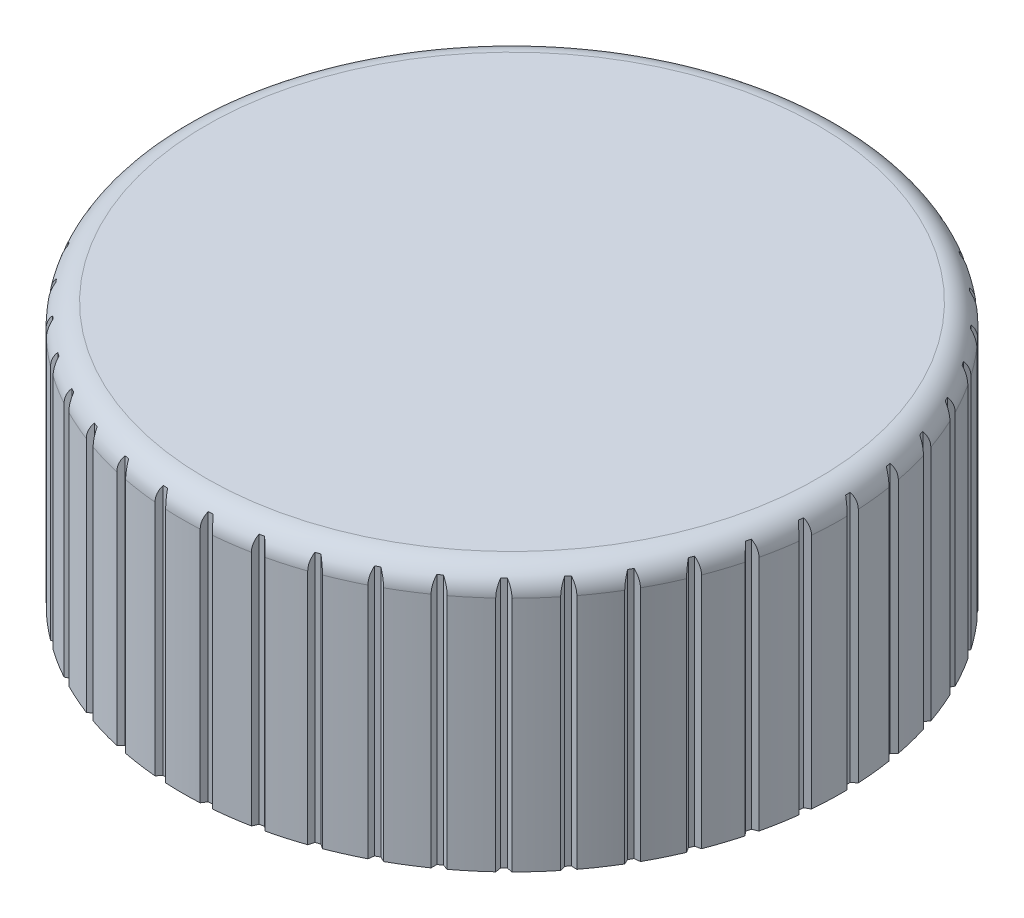
from build123d import *

# Parameters (mm, degrees)
SKETCH_1_R          = 13.9
EXTRUDE_1_DEPTH     = 11
SKETCH_2_R          = 2.95
CUT_EXTRUDE_1_DEPTH = 8.8
FILLET_1_R          = 1
CUT_EXTRUDE_2_DEPTH = 9
CUT_EXTRUDE_3_DEPTH = 23.525985057


with BuildPart() as part:
    # 草图1 → 凸台-拉伸1 (new body)
    with BuildSketch(Plane(origin=(0, 0, 0), x_dir=(1, 0, 0), z_dir=(0, 1, 0))):
        with Locations(Location((0, 0, 0), (0, 0, 270))):
            Circle(SKETCH_1_R)
    extrude(amount=EXTRUDE_1_DEPTH)

    # 草图2 → 切除-拉伸1 (cut)
    with BuildSketch(Plane.XZ):
        with Locations(Location((0, 0, 0), (0, 0, 270))):
            Circle(SKETCH_2_R)
    extrude(amount=-CUT_EXTRUDE_1_DEPTH, mode=Mode.SUBTRACT)

    # 圆角1
    fillet_1_edges = [part.edges().sort_by_distance(p)[0] for p in [
        (0, 11, -13.9),
    ]]
    fillet(fillet_1_edges, radius=FILLET_1_R)

    # 草图3 → 切除-拉伸2 (cut)
    with BuildSketch(Plane.XZ):
        with BuildLine():
            Line((4.847937706, -1), (11.857908753, -1))
            ThreePointArc((11.857908753, -1), (8.414570696, -8.414570696), (1, -11.857908753))
            Line((1, -11.857908753), (1, -4.847937706))
            ThreePointArc((1, -4.847937706), (3.500178567, -3.500178567), (4.847937706, -1))
        make_face()
        with BuildLine():
            Line((1, 4.847937706), (1, 11.857908753))
            ThreePointArc((1, 11.857908753), (8.414570696, 8.414570696), (11.857908753, 1))
            Line((11.857908753, 1), (4.847937706, 1))
            ThreePointArc((4.847937706, 1), (3.500178567, 3.500178567), (1, 4.847937706))
        make_face()
        with BuildLine():
            Line((-1, 4.847937706), (-1, 11.857908753))
            ThreePointArc((-1, 11.857908753), (-8.414570696, 8.414570696), (-11.857908753, 1))
            Line((-11.857908753, 1), (-4.847937706, 1))
            ThreePointArc((-4.847937706, 1), (-3.500178567, 3.500178567), (-1, 4.847937706))
        make_face()
        with BuildLine():
            Line((-1, -4.847937706), (-1, -11.857908753))
            ThreePointArc((-1, -11.857908753), (-8.414570696, -8.414570696), (-11.857908753, -1))
            Line((-11.857908753, -1), (-4.847937706, -1))
            ThreePointArc((-4.847937706, -1), (-3.500178567, -3.500178567), (-1, -4.847937706))
        make_face()
    extrude(amount=-CUT_EXTRUDE_2_DEPTH, mode=Mode.SUBTRACT)

    # 草图5 → 切除-拉伸3 (cut, through all)
    with BuildSketch(Plane(origin=(0, 11, 0), x_dir=(1, 0, 0), z_dir=(0, 1, 0))):
        with BuildLine():
            Line((1.906671483, 13.566672542), (1.807644676, 13.580589852))
            Line((1.807644676, 13.580589852), (1.693983873, 13.796391508))
            ThreePointArc((1.693983873, 13.796391508), (1.934506103, 13.764726156), (2.174439064, 13.728867934))
            Line((2.174439064, 13.728867934), (2.00569829, 13.552755232))
            Line((2.00569829, 13.552755232), (1.906671483, 13.566672542))
        make_face()
        with BuildLine():
            Line((0, 13.7), (-0.1, 13.7))
            Line((-0.1, 13.7), (-0.242588449, 13.897882963))
            ThreePointArc((-0.242588449, 13.897882963), (0, 13.9), (0.242588449, 13.897882963))
            Line((0.242588449, 13.897882963), (0.1, 13.7))
            Line((0.1, 13.7), (0, 13.7))
        make_face()
        with BuildLine():
            Line((3.776231775, 13.169285234), (3.680105605, 13.19684897))
            Line((3.680105605, 13.19684897), (3.597584727, 13.426368985))
            ThreePointArc((3.597584727, 13.426368985), (3.831359246, 13.361537574), (4.063966696, 13.292636108))
            Line((4.063966696, 13.292636108), (3.872357944, 13.141721499))
            Line((3.872357944, 13.141721499), (3.776231775, 13.169285234))
        make_face()
        with BuildLine():
            Line((5.57229201, 12.51557277), (5.480937464, 12.556246434))
            Line((5.480937464, 12.556246434), (5.431162686, 12.795017463))
            ThreePointArc((5.431162686, 12.795017463), (5.653639339, 12.698281861), (5.874393838, 12.59767824))
            Line((5.874393838, 12.59767824), (5.663646556, 12.474899105))
            Line((5.663646556, 12.474899105), (5.57229201, 12.51557277))
        make_face()
        with BuildLine():
            Line((7.25989392, 11.618258917), (7.17508911, 11.671250844))
            Line((7.17508911, 11.671250844), (7.159029241, 11.91462548))
            ThreePointArc((7.159029241, 11.91462548), (7.365877773, 11.787868537), (7.570482587, 11.657520894))
            Line((7.570482587, 11.657520894), (7.34469873, 11.565266991))
            Line((7.34469873, 11.565266991), (7.25989392, 11.618258917))
        make_face()
        with BuildLine():
            Line((8.806190253, 10.494808871), (8.729585808, 10.559087632))
            Line((8.729585808, 10.559087632), (8.747553436, 10.802328864))
            ThreePointArc((8.747553436, 10.802328864), (8.934747775, 10.648017759), (9.119220503, 10.490463165))
            Line((9.119220503, 10.490463165), (8.882794697, 10.43053011))
            Line((8.882794697, 10.43053011), (8.806190253, 10.494808871))
        make_face()
        with BuildLine():
            Line((10.181084109, 9.167089307), (10.114171048, 9.24140379))
            Line((10.114171048, 9.24140379), (10.165816453, 9.479777205))
            ThreePointArc((10.165816453, 9.479777205), (10.329713074, 9.300915428), (10.490463165, 9.119220503))
            Line((10.490463165, 9.119220503), (10.24799717, 9.092774825))
            Line((10.24799717, 9.092774825), (10.181084109, 9.167089307))
        make_face()
        with BuildLine():
            Line((11.357814744, 7.660942778), (11.301895454, 7.743846535))
            Line((11.301895454, 7.743846535), (11.386213416, 7.972712465))
            ThreePointArc((11.386213416, 7.972712465), (11.523622259, 7.772781358), (11.657520894, 7.570482587))
            Line((11.657520894, 7.570482587), (11.413734034, 7.57803902))
            Line((11.413734034, 7.57803902), (11.357814744, 7.660942778))
        make_face()
        with BuildLine():
            Line((12.313478434, 6.005684711), (12.26964132, 6.095564116))
            Line((12.26964132, 6.095564116), (12.384990686, 6.310467946))
            ThreePointArc((12.384990686, 6.310467946), (12.493237244, 6.09335894), (12.59767824, 5.874393838))
            Line((12.59767824, 5.874393838), (12.357315549, 5.915805306))
            Line((12.357315549, 5.915805306), (12.313478434, 6.005684711))
        make_face()
        with BuildLine():
            Line((13.029474273, 4.233532823), (12.998572574, 4.328638475))
            Line((12.998572574, 4.328638475), (13.142708201, 4.525397347))
            ThreePointArc((13.142708201, 4.525397347), (13.219685577, 4.295336222), (13.292636108, 4.063966696))
            Line((13.292636108, 4.063966696), (13.060375973, 4.138427171))
            Line((13.060375973, 4.138427171), (13.029474273, 4.233532823))
        make_face()
        with BuildLine():
            Line((13.491866216, 2.378980034), (13.474501399, 2.477460809))
            Line((13.474501399, 2.477460809), (13.64461785, 2.652245036))
            ThreePointArc((13.64461785, 2.652245036), (13.688827767, 2.41370967), (13.728867934, 2.174439064))
            Line((13.728867934, 2.174439064), (13.509231034, 2.280499259))
            Line((13.509231034, 2.280499259), (13.491866216, 2.378980034))
        make_face()
        with BuildLine():
            Line((13.69165433, 0.478123105), (13.68816438, 0.578062188))
            Line((13.68816438, 0.578062188), (13.880950533, 0.727469792))
            ThreePointArc((13.880950533, 0.727469792), (13.891532496, 0.485103004), (13.897882963, 0.242588449))
            Line((13.897882963, 0.242588449), (13.69514428, 0.378184022))
            Line((13.69514428, 0.378184022), (13.69165433, 0.478123105))
        make_face()
        with BuildLine():
            Line((13.624949967, -1.432039947), (13.635402813, -1.332587757))
            Line((13.635402813, -1.332587757), (13.847106303, -1.211464824))
            ThreePointArc((13.847106303, -1.211464824), (13.823854346, -1.452945639), (13.796391508, -1.693983873))
            Line((13.796391508, -1.693983873), (13.61449712, -1.531492136))
            Line((13.61449712, -1.531492136), (13.624949967, -1.432039947))
        make_face()
        with BuildLine():
            Line((13.29305145, -3.31432997), (13.31724364, -3.217300397))
            Line((13.31724364, -3.217300397), (13.543743901, -3.126819655))
            ThreePointArc((13.543743901, -3.126819655), (13.487110595, -3.362714349), (13.426368985, -3.597584727))
            Line((13.426368985, -3.597584727), (13.26885926, -3.411359542))
            Line((13.26885926, -3.411359542), (13.29305145, -3.31432997))
        make_face()
        with BuildLine():
            Line((12.702418808, -5.13211033), (12.739879467, -5.039391944))
            Line((12.739879467, -5.039391944), (12.976767928, -4.981314499))
            ThreePointArc((12.976767928, -4.981314499), (12.887855578, -5.207031648), (12.795017463, -5.431162686))
            Line((12.795017463, -5.431162686), (12.664958148, -5.224828715))
            Line((12.664958148, -5.224828715), (12.702418808, -5.13211033))
        make_face()
        with BuildLine():
            Line((11.864548032, -6.85), (11.914548032, -6.76339746))
            Line((11.914548032, -6.76339746), (12.157213929, -6.738853721))
            ThreePointArc((12.157213929, -6.738853721), (12.037753113, -6.95), (11.91462548, -7.159029241))
            Line((11.91462548, -7.159029241), (11.814548032, -6.93660254))
            Line((11.814548032, -6.93660254), (11.864548032, -6.85))
        make_face()
        with BuildLine():
            Line((10.795747324, -8.434562212), (10.857313472, -8.355761137))
            Line((10.857313472, -8.355761137), (11.10103359, -8.365228822))
            ThreePointArc((11.10103359, -8.365228822), (10.953349475, -8.557694507), (10.802328864, -8.747553436))
            Line((10.802328864, -8.747553436), (10.734181177, -8.513363287))
            Line((10.734181177, -8.513363287), (10.795747324, -8.434562212))
        make_face()
        with BuildLine():
            Line((9.516819675, -9.854955265), (9.588753655, -9.785489428))
            Line((9.588753655, -9.785489428), (9.828784258, -9.828784258))
            ThreePointArc((9.828784258, -9.828784258), (9.655751349, -9.998823225), (9.479777205, -10.165816453))
            Line((9.479777205, -10.165816453), (9.444885695, -9.924421102))
            Line((9.444885695, -9.924421102), (9.516819675, -9.854955265))
        make_face()
        with BuildLine():
            Line((8.052657956, -11.083532823), (8.133559656, -11.024754298))
            Line((8.133559656, -11.024754298), (8.365228822, -11.10103359))
            ThreePointArc((8.365228822, -11.10103359), (8.170215007, -11.245336222), (7.972712465, -11.386213416))
            Line((7.972712465, -11.386213416), (7.971756257, -11.142311348))
            Line((7.971756257, -11.142311348), (8.052657956, -11.083532823))
        make_face()
        with BuildLine():
            Line((6.43176041, -12.096382022), (6.520055169, -12.049434866))
            Line((6.520055169, -12.049434866), (6.738853721, -12.157213929))
            ThreePointArc((6.738853721, -12.157213929), (6.525654723, -12.272971541), (6.310467946, -12.384990686))
            Line((6.310467946, -12.384990686), (6.343465651, -12.143329178))
            Line((6.343465651, -12.143329178), (6.43176041, -12.096382022))
        make_face()
        with BuildLine():
            Line((4.685675964, -12.873788905), (4.779645226, -12.83958689))
            Line((4.779645226, -12.83958689), (4.981314499, -12.976767928))
            ThreePointArc((4.981314499, -12.976767928), (4.754079992, -13.061727429), (4.525397347, -13.142708201))
            Line((4.525397347, -13.142708201), (4.591706701, -12.907990919))
            Line((4.591706701, -12.907990919), (4.685675964, -12.873788905))
        make_face()
        with BuildLine():
            Line((2.848390164, -13.40062213), (2.946204924, -13.379830961))
            Line((2.946204924, -13.379830961), (3.126819655, -13.543743901))
            ThreePointArc((3.126819655, -13.543743901), (2.889972502, -13.59625165), (2.652245036, -13.64461785))
            Line((2.652245036, -13.64461785), (2.750575404, -13.421413299))
            Line((2.750575404, -13.421413299), (2.848390164, -13.40062213))
        make_face()
        with BuildLine():
            Line((0.95566369, -13.666627489), (1.055420095, -13.659651841))
            Line((1.055420095, -13.659651841), (1.211464824, -13.847106303))
            ThreePointArc((1.211464824, -13.847106303), (0.969614985, -13.866140299), (0.727469792, -13.880950533))
            Line((0.727469792, -13.880950533), (0.855907285, -13.673603136))
            Line((0.855907285, -13.673603136), (0.95566369, -13.666627489))
        make_face()
        with BuildLine():
            Line((-0.95566369, -13.666627489), (-0.855907285, -13.673603136))
            Line((-0.855907285, -13.673603136), (-0.727469792, -13.880950533))
            ThreePointArc((-0.727469792, -13.880950533), (-0.969614985, -13.866140299), (-1.211464824, -13.847106303))
            Line((-1.211464824, -13.847106303), (-1.055420095, -13.659651841))
            Line((-1.055420095, -13.659651841), (-0.95566369, -13.666627489))
        make_face()
        with BuildLine():
            Line((-2.848390164, -13.40062213), (-2.750575404, -13.421413299))
            Line((-2.750575404, -13.421413299), (-2.652245036, -13.64461785))
            ThreePointArc((-2.652245036, -13.64461785), (-2.889972502, -13.59625165), (-3.126819655, -13.543743901))
            Line((-3.126819655, -13.543743901), (-2.946204924, -13.379830961))
            Line((-2.946204924, -13.379830961), (-2.848390164, -13.40062213))
        make_face()
        with BuildLine():
            Line((-4.685675964, -12.873788905), (-4.591706701, -12.907990919))
            Line((-4.591706701, -12.907990919), (-4.525397347, -13.142708201))
            ThreePointArc((-4.525397347, -13.142708201), (-4.754079992, -13.061727429), (-4.981314499, -12.976767928))
            Line((-4.981314499, -12.976767928), (-4.779645226, -12.83958689))
            Line((-4.779645226, -12.83958689), (-4.685675964, -12.873788905))
        make_face()
        with BuildLine():
            Line((-6.43176041, -12.096382022), (-6.343465651, -12.143329178))
            Line((-6.343465651, -12.143329178), (-6.310467946, -12.384990686))
            ThreePointArc((-6.310467946, -12.384990686), (-6.525654723, -12.272971541), (-6.738853721, -12.157213929))
            Line((-6.738853721, -12.157213929), (-6.520055169, -12.049434866))
            Line((-6.520055169, -12.049434866), (-6.43176041, -12.096382022))
        make_face()
        with BuildLine():
            Line((-8.052657956, -11.083532823), (-7.971756257, -11.142311348))
            Line((-7.971756257, -11.142311348), (-7.972712465, -11.386213416))
            ThreePointArc((-7.972712465, -11.386213416), (-8.170215007, -11.245336222), (-8.365228822, -11.10103359))
            Line((-8.365228822, -11.10103359), (-8.133559656, -11.024754298))
            Line((-8.133559656, -11.024754298), (-8.052657956, -11.083532823))
        make_face()
        with BuildLine():
            Line((-9.516819675, -9.854955265), (-9.444885695, -9.924421102))
            Line((-9.444885695, -9.924421102), (-9.479777205, -10.165816453))
            ThreePointArc((-9.479777205, -10.165816453), (-9.655751349, -9.998823225), (-9.828784258, -9.828784258))
            Line((-9.828784258, -9.828784258), (-9.588753655, -9.785489428))
            Line((-9.588753655, -9.785489428), (-9.516819675, -9.854955265))
        make_face()
        with BuildLine():
            Line((-10.795747324, -8.434562212), (-10.734181177, -8.513363287))
            Line((-10.734181177, -8.513363287), (-10.802328864, -8.747553436))
            ThreePointArc((-10.802328864, -8.747553436), (-10.953349475, -8.557694507), (-11.10103359, -8.365228822))
            Line((-11.10103359, -8.365228822), (-10.857313472, -8.355761137))
            Line((-10.857313472, -8.355761137), (-10.795747324, -8.434562212))
        make_face()
        with BuildLine():
            Line((-11.864548032, -6.85), (-11.814548032, -6.93660254))
            Line((-11.814548032, -6.93660254), (-11.91462548, -7.159029241))
            ThreePointArc((-11.91462548, -7.159029241), (-12.037753113, -6.95), (-12.157213929, -6.738853721))
            Line((-12.157213929, -6.738853721), (-11.914548032, -6.76339746))
            Line((-11.914548032, -6.76339746), (-11.864548032, -6.85))
        make_face()
        with BuildLine():
            Line((-12.702418808, -5.13211033), (-12.664958148, -5.224828715))
            Line((-12.664958148, -5.224828715), (-12.795017463, -5.431162686))
            ThreePointArc((-12.795017463, -5.431162686), (-12.887855578, -5.207031648), (-12.976767928, -4.981314499))
            Line((-12.976767928, -4.981314499), (-12.739879467, -5.039391944))
            Line((-12.739879467, -5.039391944), (-12.702418808, -5.13211033))
        make_face()
        with BuildLine():
            Line((-13.29305145, -3.31432997), (-13.26885926, -3.411359542))
            Line((-13.26885926, -3.411359542), (-13.426368985, -3.597584727))
            ThreePointArc((-13.426368985, -3.597584727), (-13.487110595, -3.362714349), (-13.543743901, -3.126819655))
            Line((-13.543743901, -3.126819655), (-13.31724364, -3.217300397))
            Line((-13.31724364, -3.217300397), (-13.29305145, -3.31432997))
        make_face()
        with BuildLine():
            Line((-13.624949967, -1.432039947), (-13.61449712, -1.531492136))
            Line((-13.61449712, -1.531492136), (-13.796391508, -1.693983873))
            ThreePointArc((-13.796391508, -1.693983873), (-13.823854346, -1.452945639), (-13.847106303, -1.211464824))
            Line((-13.847106303, -1.211464824), (-13.635402813, -1.332587757))
            Line((-13.635402813, -1.332587757), (-13.624949967, -1.432039947))
        make_face()
        with BuildLine():
            Line((-13.69165433, 0.478123105), (-13.69514428, 0.378184022))
            Line((-13.69514428, 0.378184022), (-13.897882963, 0.242588449))
            ThreePointArc((-13.897882963, 0.242588449), (-13.891532496, 0.485103004), (-13.880950533, 0.727469792))
            Line((-13.880950533, 0.727469792), (-13.68816438, 0.578062188))
            Line((-13.68816438, 0.578062188), (-13.69165433, 0.478123105))
        make_face()
        with BuildLine():
            Line((-13.491866216, 2.378980034), (-13.509231034, 2.280499259))
            Line((-13.509231034, 2.280499259), (-13.728867934, 2.174439064))
            ThreePointArc((-13.728867934, 2.174439064), (-13.688827767, 2.41370967), (-13.64461785, 2.652245036))
            Line((-13.64461785, 2.652245036), (-13.474501399, 2.477460809))
            Line((-13.474501399, 2.477460809), (-13.491866216, 2.378980034))
        make_face()
        with BuildLine():
            Line((-13.029474273, 4.233532823), (-13.060375973, 4.138427171))
            Line((-13.060375973, 4.138427171), (-13.292636108, 4.063966696))
            ThreePointArc((-13.292636108, 4.063966696), (-13.219685577, 4.295336222), (-13.142708201, 4.525397347))
            Line((-13.142708201, 4.525397347), (-12.998572574, 4.328638475))
            Line((-12.998572574, 4.328638475), (-13.029474273, 4.233532823))
        make_face()
        with BuildLine():
            Line((-12.313478434, 6.005684711), (-12.357315549, 5.915805306))
            Line((-12.357315549, 5.915805306), (-12.59767824, 5.874393838))
            ThreePointArc((-12.59767824, 5.874393838), (-12.493237244, 6.09335894), (-12.384990686, 6.310467946))
            Line((-12.384990686, 6.310467946), (-12.26964132, 6.095564116))
            Line((-12.26964132, 6.095564116), (-12.313478434, 6.005684711))
        make_face()
        with BuildLine():
            Line((-11.357814744, 7.660942778), (-11.413734034, 7.57803902))
            Line((-11.413734034, 7.57803902), (-11.657520894, 7.570482587))
            ThreePointArc((-11.657520894, 7.570482587), (-11.523622259, 7.772781358), (-11.386213416, 7.972712465))
            Line((-11.386213416, 7.972712465), (-11.301895454, 7.743846535))
            Line((-11.301895454, 7.743846535), (-11.357814744, 7.660942778))
        make_face()
        with BuildLine():
            Line((-10.181084109, 9.167089307), (-10.24799717, 9.092774825))
            Line((-10.24799717, 9.092774825), (-10.490463165, 9.119220503))
            ThreePointArc((-10.490463165, 9.119220503), (-10.329713074, 9.300915428), (-10.165816453, 9.479777205))
            Line((-10.165816453, 9.479777205), (-10.114171048, 9.24140379))
            Line((-10.114171048, 9.24140379), (-10.181084109, 9.167089307))
        make_face()
        with BuildLine():
            Line((-8.806190253, 10.494808871), (-8.882794697, 10.43053011))
            Line((-8.882794697, 10.43053011), (-9.119220503, 10.490463165))
            ThreePointArc((-9.119220503, 10.490463165), (-8.934747775, 10.648017759), (-8.747553436, 10.802328864))
            Line((-8.747553436, 10.802328864), (-8.729585808, 10.559087632))
            Line((-8.729585808, 10.559087632), (-8.806190253, 10.494808871))
        make_face()
        with BuildLine():
            Line((-7.25989392, 11.618258917), (-7.34469873, 11.565266991))
            Line((-7.34469873, 11.565266991), (-7.570482587, 11.657520894))
            ThreePointArc((-7.570482587, 11.657520894), (-7.365877773, 11.787868537), (-7.159029241, 11.91462548))
            Line((-7.159029241, 11.91462548), (-7.17508911, 11.671250844))
            Line((-7.17508911, 11.671250844), (-7.25989392, 11.618258917))
        make_face()
        with BuildLine():
            Line((-5.57229201, 12.51557277), (-5.663646556, 12.474899105))
            Line((-5.663646556, 12.474899105), (-5.874393838, 12.59767824))
            ThreePointArc((-5.874393838, 12.59767824), (-5.653639339, 12.698281861), (-5.431162686, 12.795017463))
            Line((-5.431162686, 12.795017463), (-5.480937464, 12.556246434))
            Line((-5.480937464, 12.556246434), (-5.57229201, 12.51557277))
        make_face()
        with BuildLine():
            Line((-3.776231775, 13.169285234), (-3.872357944, 13.141721499))
            Line((-3.872357944, 13.141721499), (-4.063966696, 13.292636108))
            ThreePointArc((-4.063966696, 13.292636108), (-3.831359246, 13.361537574), (-3.597584727, 13.426368985))
            Line((-3.597584727, 13.426368985), (-3.680105605, 13.19684897))
            Line((-3.680105605, 13.19684897), (-3.776231775, 13.169285234))
        make_face()
        with BuildLine():
            Line((-1.906671483, 13.566672542), (-2.00569829, 13.552755232))
            Line((-2.00569829, 13.552755232), (-2.174439064, 13.728867934))
            ThreePointArc((-2.174439064, 13.728867934), (-1.934506103, 13.764726156), (-1.693983873, 13.796391508))
            Line((-1.693983873, 13.796391508), (-1.807644676, 13.580589852))
            Line((-1.807644676, 13.580589852), (-1.906671483, 13.566672542))
        make_face()
    extrude(amount=-CUT_EXTRUDE_3_DEPTH, mode=Mode.SUBTRACT)


solid = part.part
